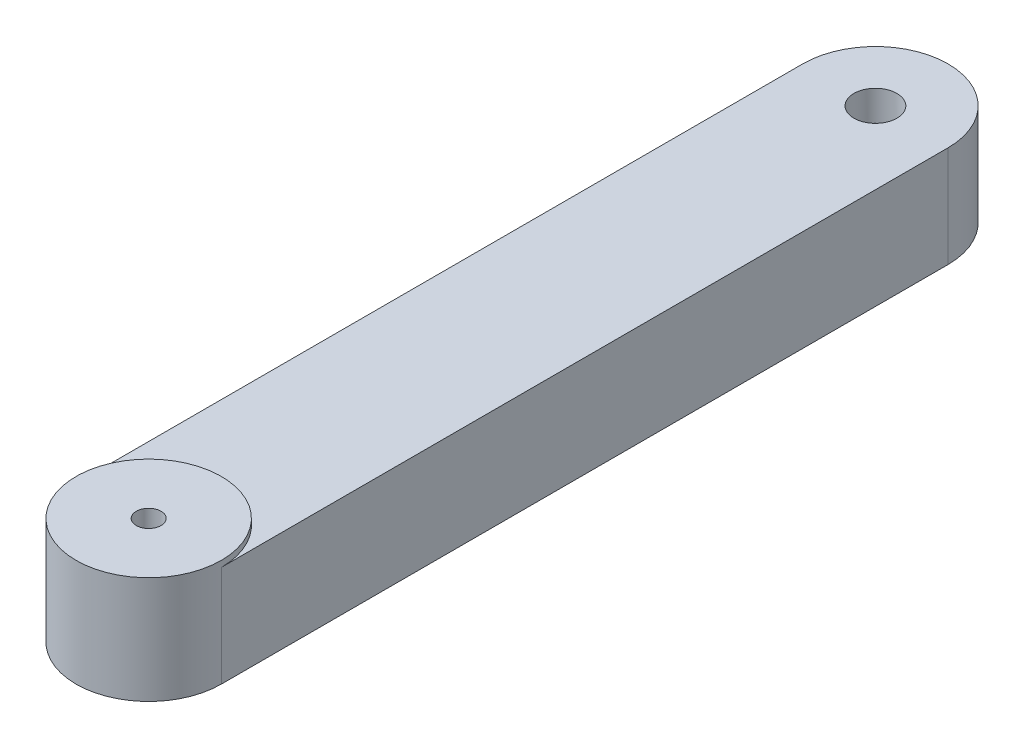
from build123d import *

# Parameters (mm, degrees)
SKETCH1_R           = 2.05
BOSS_EXTRUDE1_DEPTH = 17.7
SKETCH2_R           = 3.55
CUT_EXTRUDE1_DEPTH  = 6
CUT_EXTRUDE2_START  = -1
CUT_EXTRUDE2_DEPTH  = 1


with BuildPart() as part:
    # Sketch1 → Boss-Extrude1 (new body)
    with BuildSketch(Plane(origin=(0, 0, 0), x_dir=(1, 0, 0), z_dir=(0, 1, 0))):
        with BuildLine():
            Line((-12, -60), (-12, 60))
            ThreePointArc((-12, 60), (0, 72), (12, 60))
            Line((12, 60), (12, -60))
            ThreePointArc((12, -60), (0, -72), (-12, -60))
        make_face()
        with Locations(Location((0, 60, 0), (0, 0, 270))):
            Circle(SKETCH1_R, mode=Mode.SUBTRACT)
        with Locations(Location((0, -60, 0), (0, 0, 270))):
            Circle(SKETCH1_R, mode=Mode.SUBTRACT)
    extrude(amount=BOSS_EXTRUDE1_DEPTH)

    # Sketch2 → Cut-Extrude1 (cut)
    with BuildSketch(Plane(origin=(0, 17.7, 0), x_dir=(1, 0, 0), z_dir=(0, 1, 0))):
        with Locations(Location((0, 60, 0), (0, 0, 270))):
            Circle(SKETCH2_R)
    extrude(amount=-CUT_EXTRUDE1_DEPTH, mode=Mode.SUBTRACT)

    # Sketch3 → Cut-Extrude2 (cut)
    with BuildSketch(Plane(origin=(0, 17.7, 0), x_dir=(1, 0, 0), z_dir=(0, 1, 0)).offset(CUT_EXTRUDE2_START)):
        with BuildLine():
            Line((12, -60), (12, 60))
            ThreePointArc((12, 60), (0, 72), (-12, 60))
            Line((-12, 60), (-12, -60))
            ThreePointArc((-12, -60), (0, -48), (12, -60))
        make_face()
    extrude(amount=CUT_EXTRUDE2_DEPTH, mode=Mode.SUBTRACT)


solid = part.part
